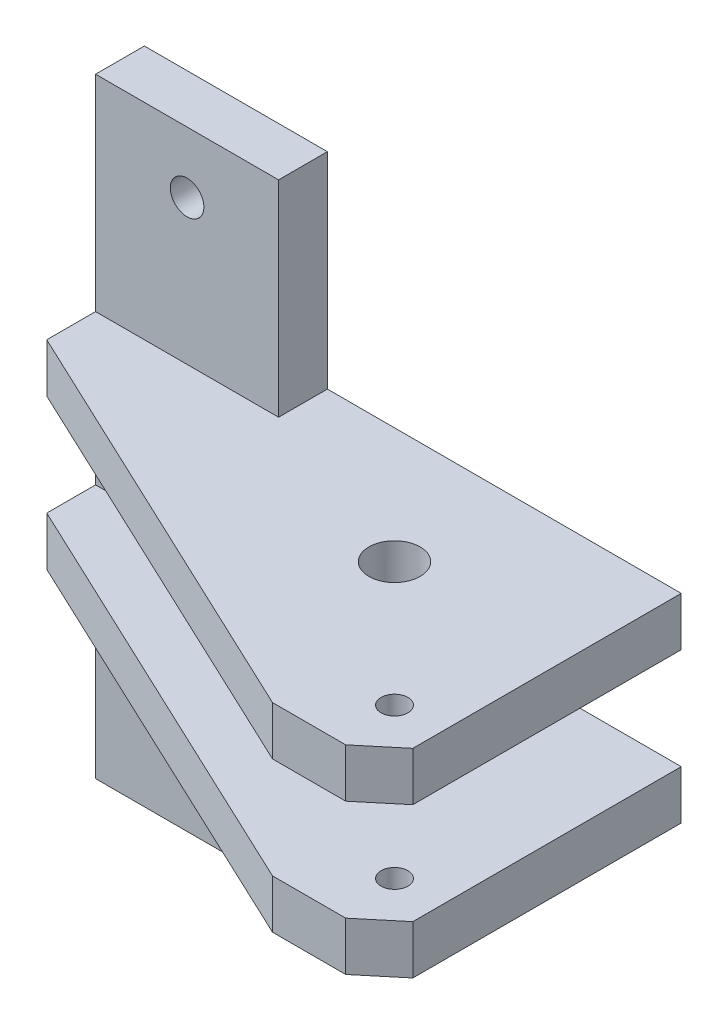
from build123d import *

# Parameters (mm, degrees)
SKETCH_1_W          = 30
SKETCH_1_H          = 100
SKETCH_1_R          = 2.75
EXTRUDE_2_DEPTH     = 8
EXTRUDE_4_DEPTH     = 16.3
CUT_EXTRUDE_1_DEPTH = 8.3
SKETCH_5_R          = 5.5
EXTRUDE_5_DEPTH     = 8.3
SKETCH_6_R          = 5.5
CUT_EXTRUDE_2_DEPTH = 7.5
SKETCH_7_R          = 4.2
SKETCH_7_R_2        = 2.2
CUT_EXTRUDE_3_DEPTH = 21.3


with BuildPart() as part:
    # 草图1 → 凸台-拉伸2 (new body)
    with BuildSketch(Plane.XY):
        with Locations((-15, 0)):
            Rectangle(SKETCH_1_W, SKETCH_1_H)
        with Locations((-15, -40)):
            Circle(SKETCH_1_R, mode=Mode.SUBTRACT)
        with Locations((-15, 40)):
            Circle(SKETCH_1_R, mode=Mode.SUBTRACT)
    extrude(amount=EXTRUDE_2_DEPTH)

    # 草图3 → 凸台-拉伸4 (add, symmetric)
    with BuildSketch(Plane(origin=(0, 0, 0), x_dir=(1, 0, 0), z_dir=(0, 1, 0))):
        Polygon((-30, 0), (58, 0), (58, -44), (52, -49), (40, -49), (-30, -16), align=None)
    extrude(amount=EXTRUDE_4_DEPTH, both=True)

    # 草图4 → 切除-拉伸1 (cut, symmetric)
    with BuildSketch(Plane(origin=(0, 0, 0), x_dir=(1, 0, 0), z_dir=(0, 1, 0))):
        Polygon((-30, -8), (0, -8), (0, 0), (58, 0), (58, -44), (52, -49), (40, -49), (-30, -16), align=None)
    extrude(amount=CUT_EXTRUDE_1_DEPTH, both=True, mode=Mode.SUBTRACT)

    # 草图5 → 凸台-拉伸5 (add, symmetric)
    with BuildSketch(Plane(origin=(0, 0, 0), x_dir=(1, 0, 0), z_dir=(0, 1, 0))):
        with Locations(Location((30, -19, 0), (0, 0, 270))):
            Circle(SKETCH_5_R)
    extrude(amount=EXTRUDE_5_DEPTH, both=True)

    # 草图6 → 切除-拉伸2 (cut, symmetric)
    with BuildSketch(Plane(origin=(0, 0, 0), x_dir=(1, 0, 0), z_dir=(0, 1, 0))):
        with Locations(Location((30, -19, 0), (0, 0, 270))):
            Circle(SKETCH_6_R)
    extrude(amount=CUT_EXTRUDE_2_DEPTH, both=True, mode=Mode.SUBTRACT)

    # 草图7 → 切除-拉伸3 (cut, symmetric)
    with BuildSketch(Plane(origin=(0, 0, 0), x_dir=(1, 0, 0), z_dir=(0, 1, 0))):
        with Locations(Location((30, -19, 0), (0, 0, 270))):
            Circle(SKETCH_7_R)
        with Locations(Location((50.364675298, -39.364675298, 0), (0, 0, 90))):
            Circle(SKETCH_7_R_2)
    extrude(amount=CUT_EXTRUDE_3_DEPTH, both=True, mode=Mode.SUBTRACT)


solid = part.part
